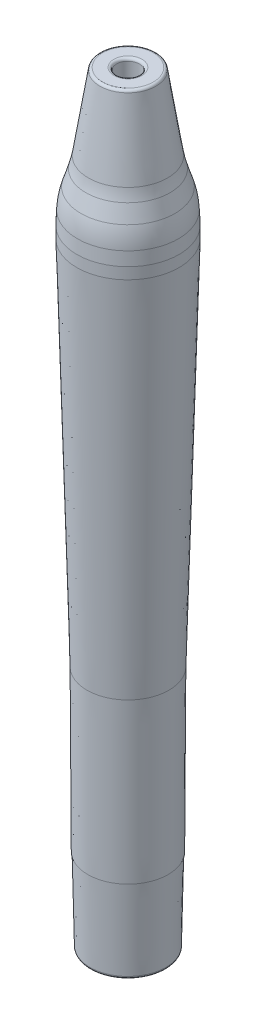
from build123d import *

# Parameters (mm, degrees)
SKETCH_3_W = 9.44
SKETCH_3_H = 2.1
FILLET_1_R = 0.5


with BuildPart() as part:
    # 草图1 → 旋转1 (revolve)
    with BuildSketch(Plane.XY):
        Polygon((14.187329426, 38.64530146), (23.627329426, 38.64530146), (21.757329426, -29.909198757), (14.187329426, -29.909198757), align=None)
    revolve(axis=Axis((14.187329426, -29.909198757, 0), (0, 1, 0)))

    # 草图3 → 旋转2 (revolve)
    with BuildSketch(Plane.XY, mode=Mode.PRIVATE) as revolve_2_sk:
        with Locations((18.907329426, 39.69530146)):
            Rectangle(SKETCH_3_W, SKETCH_3_H)
    revolve(revolve_2_sk.sketch.rotate(Axis((14.187329426, 40.74530146, 0), (0, -1, 0)), 90), axis=Axis((14.187329426, 40.74530146, 0), (0, -1, 0)))

    # 草图5 → 旋转3 (revolve)
    with BuildSketch(Plane.XY, mode=Mode.PRIVATE) as revolve_3_sk:
        with BuildLine():
            Line((14.187329426, 40.74530146), (23.627329426, 40.74530146))
            Line((23.627329426, 40.74530146), (23.513107962, 43.195284059))
            ThreePointArc((23.513107962, 43.195284059), (23.30590626, 45.076327762), (22.863511042, 46.916312662))
            Line((22.863511042, 46.916312662), (21.973239823, 49.803743827))
            ThreePointArc((21.973239823, 49.803743827), (21.691526032, 50.850327778), (21.486119968, 51.914521827))
            Line((21.486119968, 51.914521827), (19.297329426, 65.96530146))
            Line((19.297329426, 65.96530146), (16.287329426, 65.96530146))
            Line((16.287329426, 65.96530146), (16.287329426, 60.46530146))
            Line((16.287329426, 60.46530146), (14.187329426, 60.46530146))
            Line((14.187329426, 60.46530146), (14.187329426, 40.74530146))
        make_face()
    revolve(revolve_3_sk.sketch.rotate(Axis((14.187329426, 60.46530146, 0), (0, -1, 0)), 180), axis=Axis((14.187329426, 60.46530146, 0), (0, -1, 0)))

    # 草图6 → 旋转4 (revolve)
    with BuildSketch(Plane.XY, mode=Mode.PRIVATE) as revolve_4_sk:
        Polygon((14.187329426, -29.909198757), (21.757329426, -29.909198757), (21.607329426, -59.478818302), (21.497329426, -59.478818302), (21.177329426, -75.027006041), (14.187329426, -75.027006041), (14.187329426, -59.478818302), align=None)
    revolve(revolve_4_sk.sketch.rotate(Axis((14.187329426, -59.478818302, 0), (0, 1, 0)), 270), axis=Axis((14.187329426, -59.478818302, 0), (0, 1, 0)))

    # 圆角1
    fillet_1_edges = [part.edges().sort_by_distance(p)[0] for p in [
        (16.287329426, 65.96530146, 0),
        (19.297329426, 65.96530146, 0),
        (14.187329426, -75.027006041, -6.99),
    ]]
    fillet(fillet_1_edges, radius=FILLET_1_R)


solid = part.part
